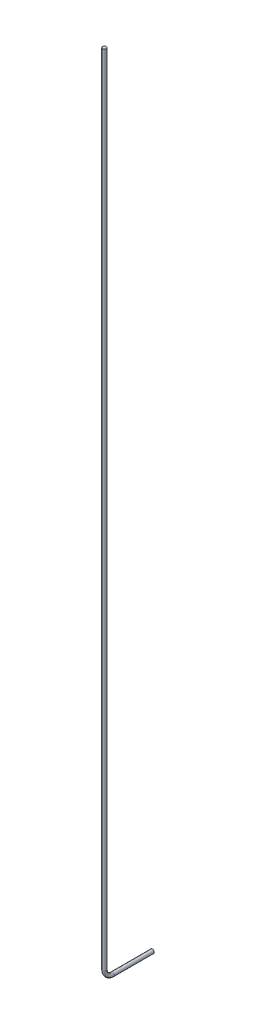
from build123d import *

# Parameters (mm, degrees)
SKETCH_1_R      = 1.2
EXTRUDE_1_DEPTH = 20
SKETCH_2_R      = 1.2


with BuildPart() as part:
    # ｽｹｯﾁ1 → ﾎﾞｽ - 押し出し1 (new body)
    with BuildSketch(Plane.XY):
        Circle(SKETCH_1_R)
    extrude(amount=EXTRUDE_1_DEPTH)

    # ｽｲｰﾌﾟ1: sweep along a path in ｽｹｯﾁ3
    with BuildLine(Plane(origin=(0, 0, 0), x_dir=(0, 0, -1), z_dir=(1, 0, 0))) as sweep_1_path:
        Line((-20, 0), (-25, 0))
        ThreePointArc((-25, 0), (-28.535533906, 1.464466094), (-30, 5))
        Line((-30, 5), (-30, 505))
    # ｽｹｯﾁ2 → ｽｲｰﾌﾟ1 (sweep)
    with BuildSketch(Plane.XY.offset(20)):
        Circle(SKETCH_2_R)
    sweep(path=sweep_1_path.line)


solid = part.part
